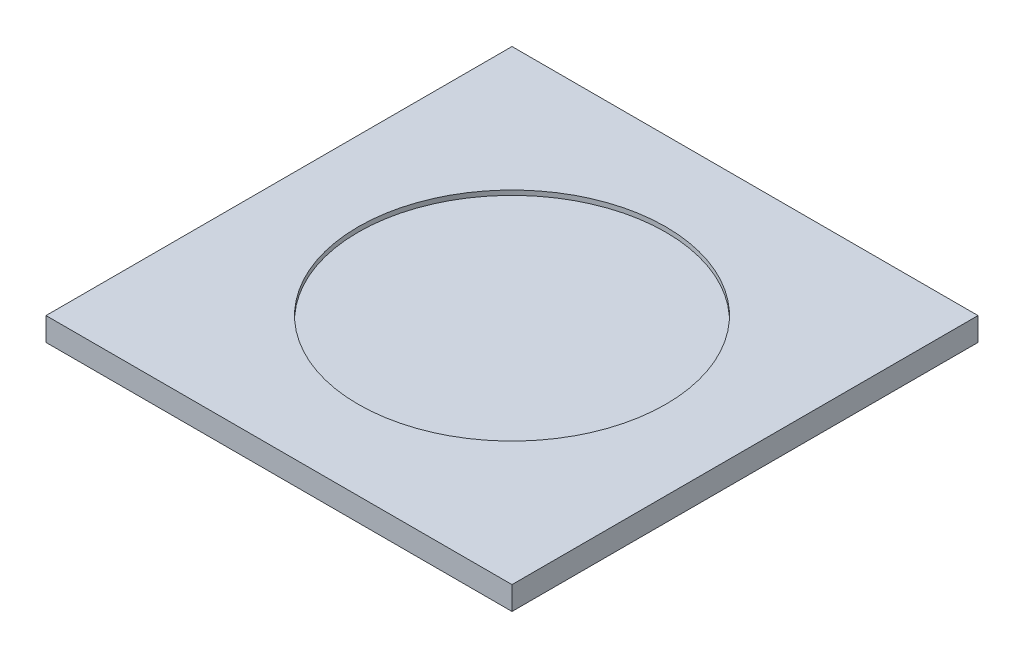
from build123d import *

# Parameters (mm, degrees)
SKETCH1_W           = 2000
SKETCH1_H           = 2000
BOSS_EXTRUDE1_DEPTH = 100
SKETCH2_R           = 660
CUT_EXTRUDE1_DEPTH  = 20


with BuildPart() as part:
    # Sketch1 → Boss-Extrude1 (new body)
    with BuildSketch(Plane(origin=(0, 0, 0), x_dir=(1, 0, 0), z_dir=(0, 1, 0))):
        Rectangle(SKETCH1_W, SKETCH1_H)
    extrude(amount=BOSS_EXTRUDE1_DEPTH)

    # Sketch2 → Cut-Extrude1 (cut)
    with BuildSketch(Plane(origin=(0, 100, 0), x_dir=(1, 0, 0), z_dir=(0, 1, 0))):
        with Locations(Location((0, 0, 0), (0, 0, 270))):
            Circle(SKETCH2_R)
    extrude(amount=-CUT_EXTRUDE1_DEPTH, mode=Mode.SUBTRACT)


solid = part.part
